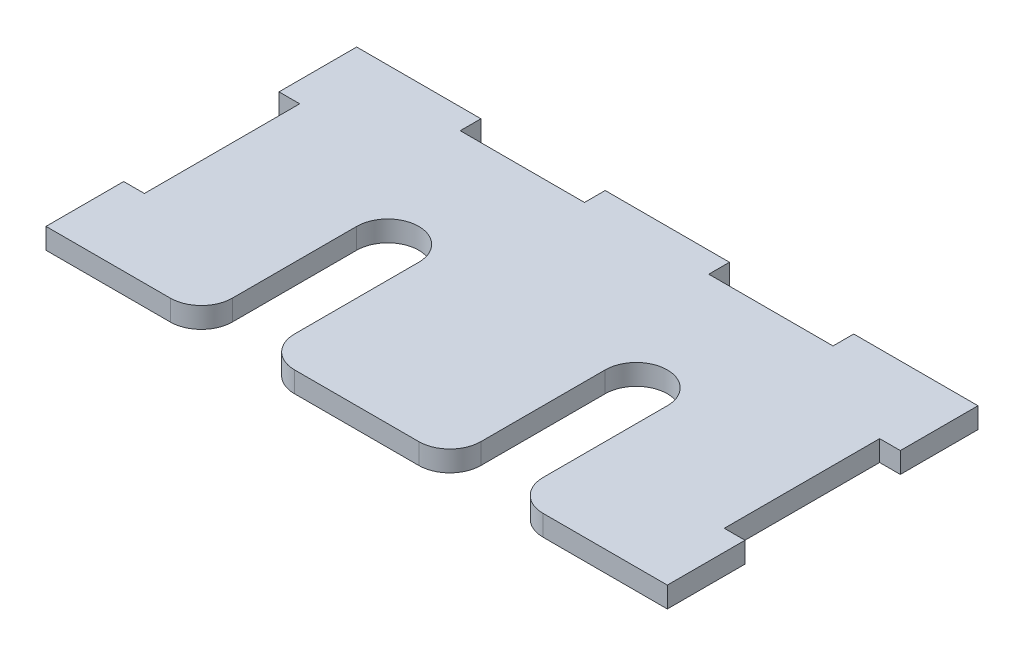
from build123d import *

# Parameters (mm, degrees)
SKETCH1_W           = 90
SKETCH1_H           = 45
BOSS_EXTRUDE1_DEPTH = 3
CUT_EXTRUDE1_DEPTH  = 3
FILLET1_R           = 4.5
SKETCH4_W           = 3
SKETCH4_H           = 22.5
SKETCH4_W_2         = 18
SKETCH4_H_2         = 3
CUT_EXTRUDE4_DEPTH  = 3


with BuildPart() as part:
    # Sketch1 → Boss-Extrude1 (new body)
    with BuildSketch(Plane(origin=(0, 0, 0), x_dir=(1, 0, 0), z_dir=(0, 1, 0))):
        Rectangle(SKETCH1_W, SKETCH1_H)
    extrude(amount=BOSS_EXTRUDE1_DEPTH)

    # Sketch2 → Cut-Extrude1 (cut)
    with BuildSketch(Plane(origin=(0, 3, 0), x_dir=(1, 0, 0), z_dir=(0, 1, 0))):
        with BuildLine():
            Line((-22.5, -22.5), (-13.5, -22.5))
            Line((-13.5, -22.5), (-13.5, 0))
            ThreePointArc((-13.5, 0), (-18, 4.5), (-22.5, 0))
            Line((-22.5, 0), (-22.5, -22.5))
        make_face()
        with BuildLine():
            Line((13.5, -22.5), (22.5, -22.5))
            Line((22.5, -22.5), (22.5, 0))
            ThreePointArc((22.5, 0), (18, 4.5), (13.5, 0))
            Line((13.5, 0), (13.5, -22.5))
        make_face()
    extrude(amount=-CUT_EXTRUDE1_DEPTH, mode=Mode.SUBTRACT)

    # Fillet1
    fillet1_edges = [part.edges().sort_by_distance(p)[0] for p in [
        (-22.5, 1.5, 22.5),
        (-13.5, 1.5, 22.5),
        (13.5, 1.5, 22.5),
        (22.5, 1.5, 22.5),
    ]]
    fillet(fillet1_edges, radius=FILLET1_R)

    # Sketch4 → Cut-Extrude4 (cut)
    with BuildSketch(Plane(origin=(0, 3, 0), x_dir=(1, 0, 0), z_dir=(0, 1, 0))):
        with Locations((-43.5, 0)):
            Rectangle(SKETCH4_W, SKETCH4_H)
        with Locations((-18, 21)):
            Rectangle(SKETCH4_W_2, SKETCH4_H_2)
        with Locations((18, 21)):
            Rectangle(SKETCH4_W_2, SKETCH4_H_2)
        with Locations((43.5, 0)):
            Rectangle(SKETCH4_W, SKETCH4_H)
    extrude(amount=-CUT_EXTRUDE4_DEPTH, mode=Mode.SUBTRACT)


solid = part.part
